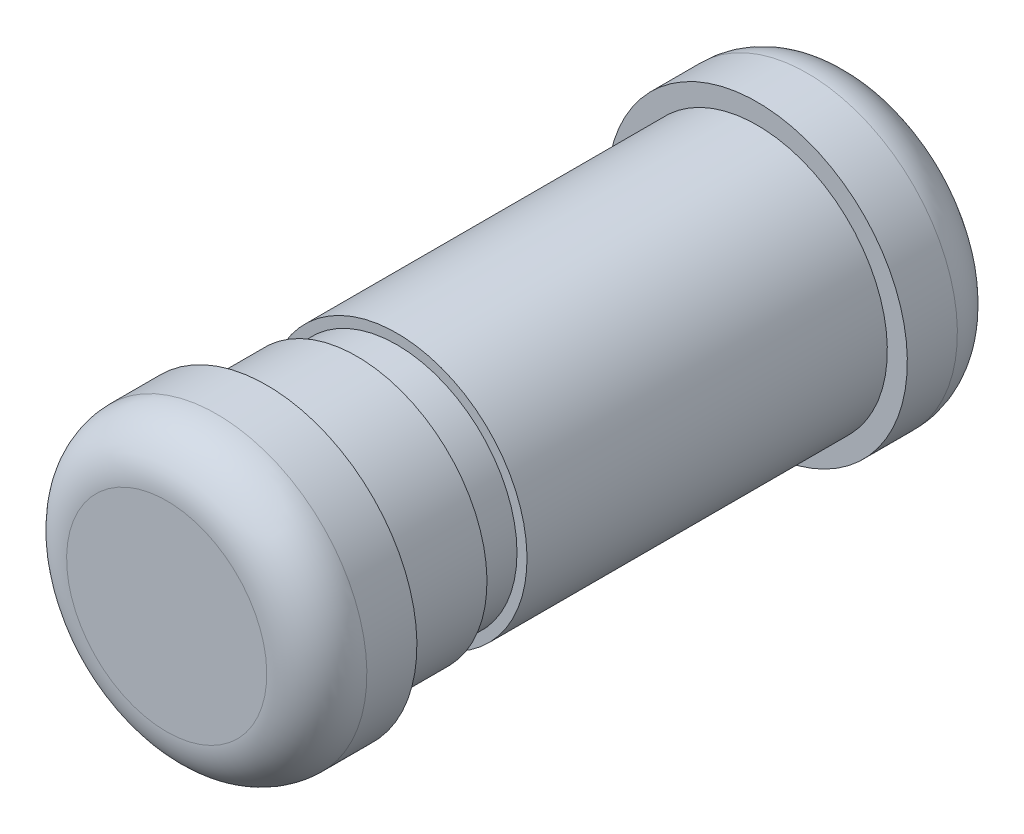
from build123d import *


with BuildPart() as part:
    # Sketch1 → Revolve1 (revolve)
    with BuildSketch(Plane(origin=(0, 0, 0), x_dir=(0, 0, -1), z_dir=(1, 0, 0))):
        with BuildLine():
            Line((-1.475, -0.75), (-1.225, -0.75))
            Line((-1.225, -0.75), (-1.225, -0.65))
            Line((-1.225, -0.65), (-0.775, -0.65))
            Line((-0.775, -0.65), (-0.775, -0.6))
            Line((-0.775, -0.6), (-0.575, -0.6))
            Line((-0.575, -0.6), (-0.575, -0.65))
            Line((-0.575, -0.65), (0.775, -0.65))
            Line((0.775, -0.65), (1.225, -0.65))
            Line((1.225, -0.65), (1.225, -0.75))
            Line((1.225, -0.75), (1.475, -0.75))
            ThreePointArc((1.475, -0.75), (1.651776695, -0.676776695), (1.725, -0.5))
            Line((1.725, -0.5), (1.725, 0))
            Line((1.725, 0), (-1.725, 0))
            Line((-1.725, 0), (-1.725, -0.5))
            ThreePointArc((-1.725, -0.5), (-1.651776695, -0.676776695), (-1.475, -0.75))
        make_face()
    revolve(axis=Axis((0, 0, 1.725), (0, 0, -1)))


solid = part.part
